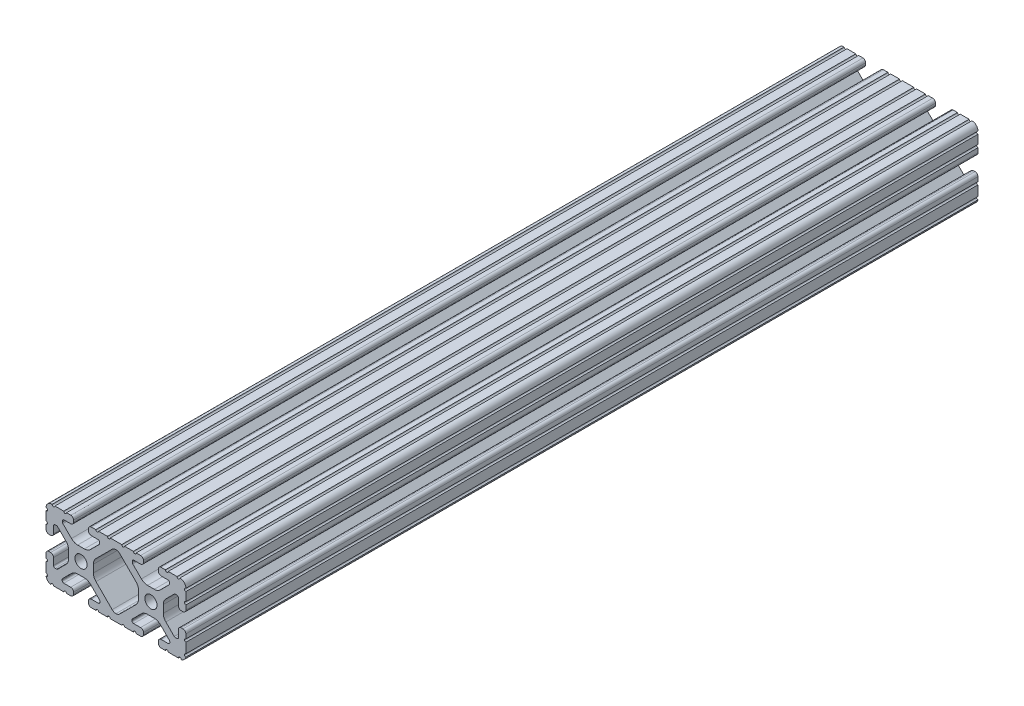
from build123d import *

# Parameters (mm, degrees)
SKETCH1_R      = 3.3274
EXTRUDE1_DEPTH = 431.8


with BuildPart() as part:
    # Sketch1 → Extrude1 (new body)
    with BuildSketch(Plane.XY):
        with BuildLine():
            Line((-3.121121376, -19.05), (3.121121376, -19.05))
            ThreePointArc((3.121121376, -19.05), (3.883121376, -18.288), (4.645121376, -19.05))
            Line((4.645121376, -19.05), (8.633115796, -19.05))
            Line((8.633115796, -19.05), (9.473536067, -19.05))
            ThreePointArc((9.473536067, -19.05), (10.235536067, -18.288), (10.997536067, -19.05))
            Line((10.997536067, -19.05), (13.4112, -19.05))
            ThreePointArc((13.4112, -19.05), (14.524751759, -18.588751759), (14.986, -17.4752))
            Line((14.986, -17.4752), (14.986, -16.5608))
            ThreePointArc((14.986, -16.5608), (14.524751759, -15.447248241), (13.4112, -14.986))
            Line((13.4112, -14.986), (9.652, -14.986))
            ThreePointArc((9.652, -14.986), (9.023382072, -14.725617928), (8.763, -14.097))
            Line((8.763, -14.097), (8.763, -13.687179678))
            ThreePointArc((8.763, -13.687179678), (8.830670671, -13.346975131), (9.023380503, -13.058563318))
            Line((9.023380503, -13.058563318), (13.852498595, -8.229421131))
            ThreePointArc((13.852498595, -8.229421131), (15.393447522, -7.199787805), (17.211122763, -6.838228541))
            Line((17.211122763, -6.838228541), (20.888877237, -6.838228541))
            ThreePointArc((20.888877237, -6.838228541), (22.706552478, -7.199787805), (24.247501405, -8.229421131))
            Line((24.247501405, -8.229421131), (29.076619497, -13.058563318))
            ThreePointArc((29.076619497, -13.058563318), (29.269329329, -13.346975131), (29.337, -13.687179678))
            Line((29.337, -13.687179678), (29.337, -14.097))
            ThreePointArc((29.337, -14.097), (29.076617928, -14.725617928), (28.448, -14.986))
            Line((28.448, -14.986), (24.6888, -14.986))
            ThreePointArc((24.6888, -14.986), (23.575248241, -15.447248241), (23.114, -16.5608))
            Line((23.114, -16.5608), (23.114, -17.4752))
            ThreePointArc((23.114, -17.4752), (23.575248241, -18.588751759), (24.6888, -19.05))
            Line((24.6888, -19.05), (26.945817469, -19.05))
            ThreePointArc((26.945817469, -19.05), (27.707817469, -18.288), (28.469817469, -19.05))
            Line((28.469817469, -19.05), (29.207115796, -19.05))
            Line((29.207115796, -19.05), (34.047273398, -19.05))
            ThreePointArc((34.047273398, -19.05), (34.809273398, -18.288), (35.571273398, -19.05))
            ThreePointArc((35.571273398, -19.05), (37.207577603, -18.182738167), (38.1, -16.560019212))
            ThreePointArc((38.1, -16.560019212), (37.338, -15.798019212), (38.1, -15.036019212))
            Line((38.1, -15.036019212), (38.1, -10.287))
            Line((38.1, -10.287), (38.1, -9.549701672))
            ThreePointArc((38.1, -9.549701672), (37.338, -8.787701672), (38.1, -8.025701672))
            Line((38.1, -8.025701672), (38.1, -5.6388))
            ThreePointArc((38.1, -5.6388), (37.638751759, -4.525248241), (36.5252, -4.064))
            Line((36.5252, -4.064), (35.6108, -4.064))
            ThreePointArc((35.6108, -4.064), (34.497248241, -4.525248241), (34.036, -5.6388))
            Line((34.036, -5.6388), (34.036, -9.398))
            ThreePointArc((34.036, -9.398), (33.775617928, -10.026617928), (33.147, -10.287))
            Line((33.147, -10.287), (32.420656743, -10.287))
            ThreePointArc((32.420656743, -10.287), (32.080450147, -10.21932848), (31.792037247, -10.02661636))
            Line((31.792037247, -10.02661636), (27.197575832, -5.43213202))
            ThreePointArc((27.197575832, -5.43213202), (26.167954729, -3.891188903), (25.8064, -2.07352461))
            Line((25.8064, -2.07352461), (25.8064, 2.07352461))
            ThreePointArc((25.8064, 2.07352461), (26.167954729, 3.891188903), (27.197575832, 5.43213202))
            Line((27.197575832, 5.43213202), (31.792037247, 10.02661636))
            ThreePointArc((31.792037247, 10.02661636), (32.080450147, 10.21932848), (32.420656743, 10.287))
            Line((32.420656743, 10.287), (33.147, 10.287))
            ThreePointArc((33.147, 10.287), (33.775617928, 10.026617928), (34.036, 9.398))
            Line((34.036, 9.398), (34.036, 5.6388))
            ThreePointArc((34.036, 5.6388), (34.497248241, 4.525248241), (35.6108, 4.064))
            Line((35.6108, 4.064), (36.5252, 4.064))
            ThreePointArc((36.5252, 4.064), (37.638751759, 4.525248241), (38.1, 5.6388))
            Line((38.1, 5.6388), (38.1, 8.025701672))
            ThreePointArc((38.1, 8.025701672), (37.338, 8.787701672), (38.1, 9.549701672))
            Line((38.1, 9.549701672), (38.1, 10.287))
            Line((38.1, 10.287), (38.1, 14.375206214))
            ThreePointArc((38.1, 14.375206214), (37.338232276, 15.156019383), (38.137614868, 15.89827725))
            ThreePointArc((38.137614868, 15.89827725), (37.148019028, 18.192014021), (34.819536496, 19.096833012))
            ThreePointArc((34.819536496, 19.096833012), (34.081312886, 18.311776389), (33.296256263, 19.05))
            Line((33.296256263, 19.05), (29.207115796, 19.05))
            Line((29.207115796, 19.05), (28.469817468, 19.05))
            ThreePointArc((28.469817468, 19.05), (27.707817468, 18.288), (26.945817468, 19.05))
            Line((26.945817468, 19.05), (24.558915796, 19.05))
            ThreePointArc((24.558915796, 19.05), (23.53023695, 18.547208069), (23.114, 17.480565346))
            Line((23.114, 17.480565346), (23.114, 16.5608))
            ThreePointArc((23.114, 16.5608), (23.575248241, 15.447248241), (24.6888, 14.986))
            Line((24.6888, 14.986), (28.295243665, 14.986))
            ThreePointArc((28.295243665, 14.986), (28.923861593, 14.725617928), (29.184243665, 14.097))
            Line((29.184243665, 14.097), (29.184243665, 13.53442258))
            ThreePointArc((29.184243665, 13.53442258), (29.116572993, 13.194218033), (28.923863161, 12.90580622))
            Line((28.923863161, 12.90580622), (24.247501405, 8.229421131))
            ThreePointArc((24.247501405, 8.229421131), (22.706552478, 7.199787805), (20.888877237, 6.838228541))
            Line((20.888877237, 6.838228541), (17.211122763, 6.838228541))
            ThreePointArc((17.211122763, 6.838228541), (15.393447522, 7.199787805), (13.852498595, 8.229421131))
            Line((13.852498595, 8.229421131), (9.176136839, 12.90580622))
            ThreePointArc((9.176136839, 12.90580622), (8.983427007, 13.194218033), (8.915756335, 13.53442258))
            Line((8.915756335, 13.53442258), (8.915756335, 14.097))
            ThreePointArc((8.915756335, 14.097), (9.176138407, 14.725617928), (9.804756335, 14.986))
            Line((9.804756335, 14.986), (13.4112, 14.986))
            ThreePointArc((13.4112, 14.986), (14.524751759, 15.447248241), (14.986, 16.5608))
            Line((14.986, 16.5608), (14.986, 17.496772581))
            ThreePointArc((14.986, 17.496772581), (14.531070222, 18.595070222), (13.432772581, 19.05))
            Line((13.432772581, 19.05), (10.997536067, 19.05))
            ThreePointArc((10.997536067, 19.05), (10.235536067, 18.288), (9.473536067, 19.05))
            Line((9.473536067, 19.05), (8.633115796, 19.05))
            Line((8.633115796, 19.05), (4.645121376, 19.05))
            ThreePointArc((4.645121376, 19.05), (3.883121376, 18.288), (3.121121376, 19.05))
            Line((3.121121376, 19.05), (-3.121121376, 19.05))
            ThreePointArc((-3.121121376, 19.05), (-3.883121376, 18.288), (-4.645121376, 19.05))
            Line((-4.645121376, 19.05), (-8.633115796, 19.05))
            Line((-8.633115796, 19.05), (-9.473536067, 19.05))
            ThreePointArc((-9.473536067, 19.05), (-10.235536067, 18.288), (-10.997536067, 19.05))
            Line((-10.997536067, 19.05), (-13.432772581, 19.05))
            ThreePointArc((-13.432772581, 19.05), (-14.531070222, 18.595070222), (-14.986, 17.496772581))
            Line((-14.986, 17.496772581), (-14.986, 16.5608))
            ThreePointArc((-14.986, 16.5608), (-14.524751759, 15.447248241), (-13.4112, 14.986))
            Line((-13.4112, 14.986), (-9.804756335, 14.986))
            ThreePointArc((-9.804756335, 14.986), (-9.176138407, 14.725617928), (-8.915756335, 14.097))
            Line((-8.915756335, 14.097), (-8.915756335, 13.53442258))
            ThreePointArc((-8.915756335, 13.53442258), (-8.983427007, 13.194218033), (-9.176136839, 12.90580622))
            Line((-9.176136839, 12.90580622), (-13.852498595, 8.229421131))
            ThreePointArc((-13.852498595, 8.229421131), (-15.393447522, 7.199787805), (-17.211122763, 6.838228541))
            Line((-17.211122763, 6.838228541), (-20.888877237, 6.838228541))
            ThreePointArc((-20.888877237, 6.838228541), (-22.706552478, 7.199787805), (-24.247501405, 8.229421131))
            Line((-24.247501405, 8.229421131), (-28.923863161, 12.90580622))
            ThreePointArc((-28.923863161, 12.90580622), (-29.116572993, 13.194218033), (-29.184243665, 13.53442258))
            Line((-29.184243665, 13.53442258), (-29.184243665, 14.097))
            ThreePointArc((-29.184243665, 14.097), (-28.923861593, 14.725617928), (-28.295243665, 14.986))
            Line((-28.295243665, 14.986), (-24.6888, 14.986))
            ThreePointArc((-24.6888, 14.986), (-23.575248241, 15.447248241), (-23.114, 16.5608))
            Line((-23.114, 16.5608), (-23.114, 17.480565346))
            ThreePointArc((-23.114, 17.480565346), (-23.53023695, 18.547208069), (-24.558915796, 19.05))
            Line((-24.558915796, 19.05), (-26.945817468, 19.05))
            ThreePointArc((-26.945817468, 19.05), (-27.707817468, 18.288), (-28.469817468, 19.05))
            Line((-28.469817468, 19.05), (-29.207115796, 19.05))
            Line((-29.207115796, 19.05), (-33.296256263, 19.05))
            ThreePointArc((-33.296256263, 19.05), (-34.081312886, 18.311776389), (-34.819536496, 19.096833012))
            ThreePointArc((-34.819536496, 19.096833012), (-37.148019028, 18.192014021), (-38.137614868, 15.89827725))
            ThreePointArc((-38.137614868, 15.89827725), (-37.338232276, 15.156019383), (-38.1, 14.375206214))
            Line((-38.1, 14.375206214), (-38.1, 10.287))
            Line((-38.1, 10.287), (-38.1, 9.549701672))
            ThreePointArc((-38.1, 9.549701672), (-37.338, 8.787701672), (-38.1, 8.025701672))
            Line((-38.1, 8.025701672), (-38.1, 5.6388))
            ThreePointArc((-38.1, 5.6388), (-37.638751759, 4.525248241), (-36.5252, 4.064))
            Line((-36.5252, 4.064), (-35.6108, 4.064))
            ThreePointArc((-35.6108, 4.064), (-34.497248241, 4.525248241), (-34.036, 5.6388))
            Line((-34.036, 5.6388), (-34.036, 9.398))
            ThreePointArc((-34.036, 9.398), (-33.775617928, 10.026617928), (-33.147, 10.287))
            Line((-33.147, 10.287), (-32.420656743, 10.287))
            ThreePointArc((-32.420656743, 10.287), (-32.080450147, 10.21932848), (-31.792037247, 10.02661636))
            Line((-31.792037247, 10.02661636), (-27.197575832, 5.43213202))
            ThreePointArc((-27.197575832, 5.43213202), (-26.167954729, 3.891188903), (-25.8064, 2.07352461))
            Line((-25.8064, 2.07352461), (-25.8064, -2.07352461))
            ThreePointArc((-25.8064, -2.07352461), (-26.167954729, -3.891188903), (-27.197575832, -5.43213202))
            Line((-27.197575832, -5.43213202), (-31.792037247, -10.02661636))
            ThreePointArc((-31.792037247, -10.02661636), (-32.080450147, -10.21932848), (-32.420656743, -10.287))
            Line((-32.420656743, -10.287), (-33.147, -10.287))
            ThreePointArc((-33.147, -10.287), (-33.775617928, -10.026617928), (-34.036, -9.398))
            Line((-34.036, -9.398), (-34.036, -5.6388))
            ThreePointArc((-34.036, -5.6388), (-34.497248241, -4.525248241), (-35.6108, -4.064))
            Line((-35.6108, -4.064), (-36.5252, -4.064))
            ThreePointArc((-36.5252, -4.064), (-37.638751759, -4.525248241), (-38.1, -5.6388))
            Line((-38.1, -5.6388), (-38.1, -8.025701672))
            ThreePointArc((-38.1, -8.025701672), (-37.338, -8.787701672), (-38.1, -9.549701672))
            Line((-38.1, -9.549701672), (-38.1, -10.287))
            Line((-38.1, -10.287), (-38.1, -15.036019212))
            ThreePointArc((-38.1, -15.036019212), (-37.338, -15.798019212), (-38.1, -16.560019212))
            ThreePointArc((-38.1, -16.560019212), (-37.20882252, -18.184002456), (-35.571273398, -19.05))
            ThreePointArc((-35.571273398, -19.05), (-34.809273398, -18.288), (-34.047273398, -19.05))
            Line((-34.047273398, -19.05), (-29.207115796, -19.05))
            Line((-29.207115796, -19.05), (-28.469817469, -19.05))
            ThreePointArc((-28.469817469, -19.05), (-27.707817469, -18.288), (-26.945817469, -19.05))
            Line((-26.945817469, -19.05), (-24.6888, -19.05))
            ThreePointArc((-24.6888, -19.05), (-23.575248241, -18.588751759), (-23.114, -17.4752))
            Line((-23.114, -17.4752), (-23.114, -16.5608))
            ThreePointArc((-23.114, -16.5608), (-23.575248241, -15.447248241), (-24.6888, -14.986))
            Line((-24.6888, -14.986), (-28.448, -14.986))
            ThreePointArc((-28.448, -14.986), (-29.076617928, -14.725617928), (-29.337, -14.097))
            Line((-29.337, -14.097), (-29.337, -13.687179678))
            ThreePointArc((-29.337, -13.687179678), (-29.269329329, -13.346975131), (-29.076619497, -13.058563318))
            Line((-29.076619497, -13.058563318), (-24.247501405, -8.229421131))
            ThreePointArc((-24.247501405, -8.229421131), (-22.706552478, -7.199787805), (-20.888877237, -6.838228541))
            Line((-20.888877237, -6.838228541), (-17.211122763, -6.838228541))
            ThreePointArc((-17.211122763, -6.838228541), (-15.393447522, -7.199787805), (-13.852498595, -8.229421131))
            Line((-13.852498595, -8.229421131), (-9.023380503, -13.058563318))
            ThreePointArc((-9.023380503, -13.058563318), (-8.830670671, -13.346975131), (-8.763, -13.687179678))
            Line((-8.763, -13.687179678), (-8.763, -14.097))
            ThreePointArc((-8.763, -14.097), (-9.023382072, -14.725617928), (-9.652, -14.986))
            Line((-9.652, -14.986), (-13.4112, -14.986))
            ThreePointArc((-13.4112, -14.986), (-14.524751759, -15.447248241), (-14.986, -16.5608))
            Line((-14.986, -16.5608), (-14.986, -17.4752))
            ThreePointArc((-14.986, -17.4752), (-14.524751759, -18.588751759), (-13.4112, -19.05))
            Line((-13.4112, -19.05), (-10.997536067, -19.05))
            ThreePointArc((-10.997536067, -19.05), (-10.235536067, -18.288), (-9.473536067, -19.05))
            Line((-9.473536067, -19.05), (-8.633115796, -19.05))
            Line((-8.633115796, -19.05), (-4.645121376, -19.05))
            ThreePointArc((-4.645121376, -19.05), (-3.883121376, -18.288), (-3.121121376, -19.05))
        make_face()
        with Locations((19.05, 0)):
            Circle(SKETCH1_R, mode=Mode.SUBTRACT)
        with Locations(Location((-19.05, 0, 0), (0, 0, 180))):
            Circle(SKETCH1_R, mode=Mode.SUBTRACT)
        with BuildLine():
            Line((2.077035361, 14.257564863), (10.902424168, 5.43213202))
            ThreePointArc((10.902424168, 5.43213202), (11.932045271, 3.891188903), (12.2936, 2.07352461))
            Line((12.2936, 2.07352461), (12.2936, -2.07352461))
            ThreePointArc((12.2936, -2.07352461), (11.932045271, -3.891188903), (10.902424168, -5.43213202))
            Line((10.902424168, -5.43213202), (2.077035361, -14.257564863))
            ThreePointArc((2.077035361, -14.257564863), (1.124045601, -14.892973012), (0, -15.113096807))
            ThreePointArc((0, -15.113096807), (-1.124045601, -14.892973012), (-2.077035361, -14.257564863))
            Line((-2.077035361, -14.257564863), (-10.902424168, -5.43213202))
            ThreePointArc((-10.902424168, -5.43213202), (-11.932045271, -3.891188903), (-12.2936, -2.07352461))
            Line((-12.2936, -2.07352461), (-12.2936, 2.07352461))
            ThreePointArc((-12.2936, 2.07352461), (-11.932045271, 3.891188903), (-10.902424168, 5.43213202))
            Line((-10.902424168, 5.43213202), (-2.077035361, 14.257564863))
            ThreePointArc((-2.077035361, 14.257564863), (-1.124045601, 14.892973012), (0, 15.113096807))
            ThreePointArc((0, 15.113096807), (1.124045601, 14.892973012), (2.077035361, 14.257564863))
        make_face(mode=Mode.SUBTRACT)
    extrude(amount=-EXTRUDE1_DEPTH)


solid = part.part
